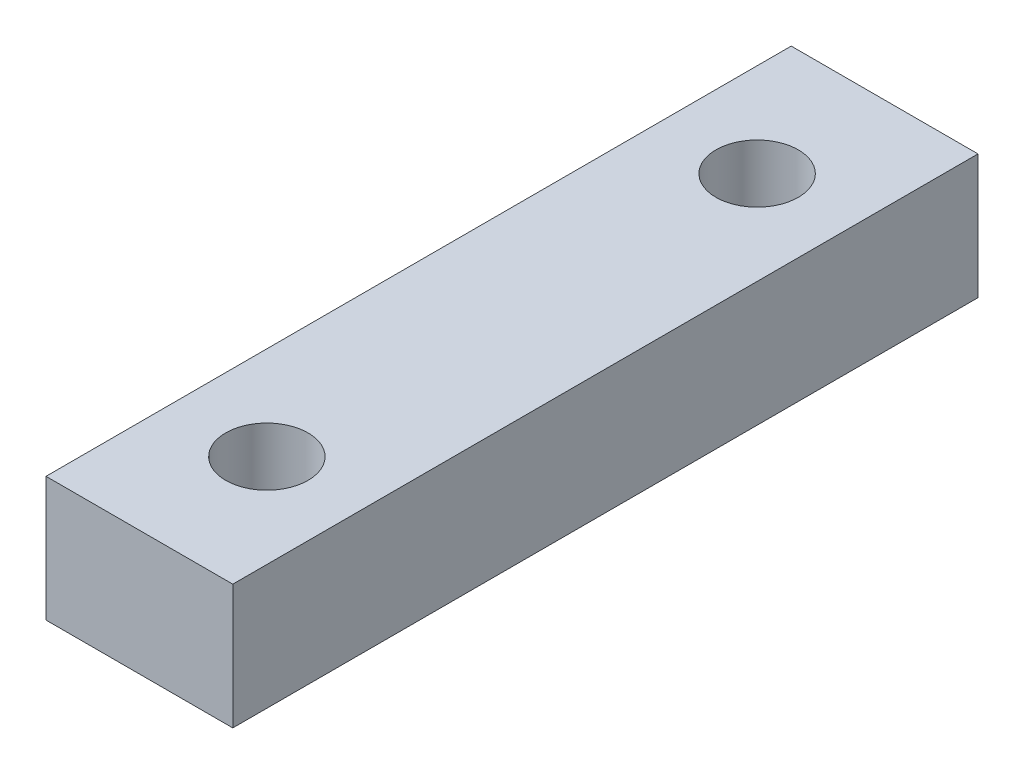
from build123d import *

# Parameters (mm, degrees)
SKETCH1_W           = 9.525
SKETCH1_H           = 6.35
BOSS_EXTRUDE1_DEPTH = 19
M5_TAPPED_HOLE1_D   = 4.2


with BuildPart() as part:
    # Sketch1 → Boss-Extrude1 (new, symmetric)
    with BuildSketch(Plane.XY):
        Rectangle(SKETCH1_W, SKETCH1_H)
    extrude(amount=BOSS_EXTRUDE1_DEPTH, both=True)

    # M5 Tapped Hole1 (through all)
    with Locations(Plane(origin=(0, 3.175, 0), x_dir=(1, 0, 0), z_dir=(0, 1, 0))):
        with Locations((0, -12.5), (0, 12.5)):
            Hole(M5_TAPPED_HOLE1_D / 2)


solid = part.part
